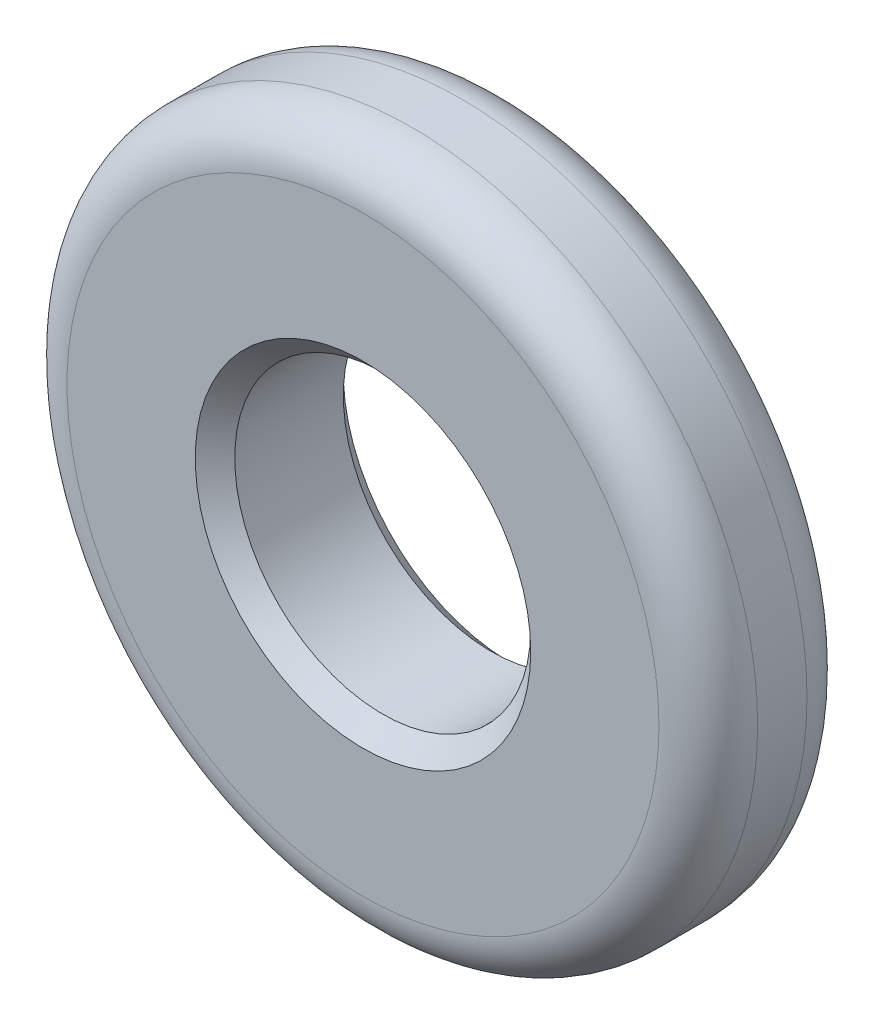
from build123d import *

# Parameters (mm, degrees)
SKETCH_1_R          = 35
EXTRUDE_1_DEPTH     = 7.5
FILLET_1_R          = 5
FILLET_2_R          = 5
SKETCH_2_R          = 15
CUT_EXTRUDE_1_DEPTH = 15
CHAMFER_1_SIZE      = 2
CHAMFER_2_SIZE      = 2
SCALE_1_SCALE       = 0.6


with BuildPart() as part:
    # 草图1 → 凸台-拉伸1 (new, symmetric)
    with BuildSketch(Plane.XY):
        Circle(SKETCH_1_R)
    extrude(amount=EXTRUDE_1_DEPTH, both=True)

    # 圆角1
    fillet_1_edges = [part.edges().sort_by_distance(p)[0] for p in [
        (-35, 0, 7.5),
    ]]
    fillet(fillet_1_edges, radius=FILLET_1_R)

    # 圆角2
    fillet_2_edges = [part.edges().sort_by_distance(p)[0] for p in [
        (-35, 0, -7.5),
    ]]
    fillet(fillet_2_edges, radius=FILLET_2_R)

    # 草图2 → 切除-拉伸1 (cut)
    with BuildSketch(Plane.XY.offset(7.5)):
        Circle(SKETCH_2_R)
    extrude(amount=-CUT_EXTRUDE_1_DEPTH, mode=Mode.SUBTRACT)

    # 倒角1
    chamfer_1_edges = [part.edges().sort_by_distance(p)[0] for p in [
        (-15, 0, 7.5),
    ]]
    chamfer(chamfer_1_edges, length=CHAMFER_1_SIZE)

    # 倒角2
    chamfer_2_edges = [part.edges().sort_by_distance(p)[0] for p in [
        (-15, 0, -7.5),
    ]]
    chamfer(chamfer_2_edges, length=CHAMFER_2_SIZE)


with BuildPart() as part_1:
    # 缩放比例1: scaled about (0, 0, 0)
    add(part.part.scale(SCALE_1_SCALE))


solid = part_1.part
